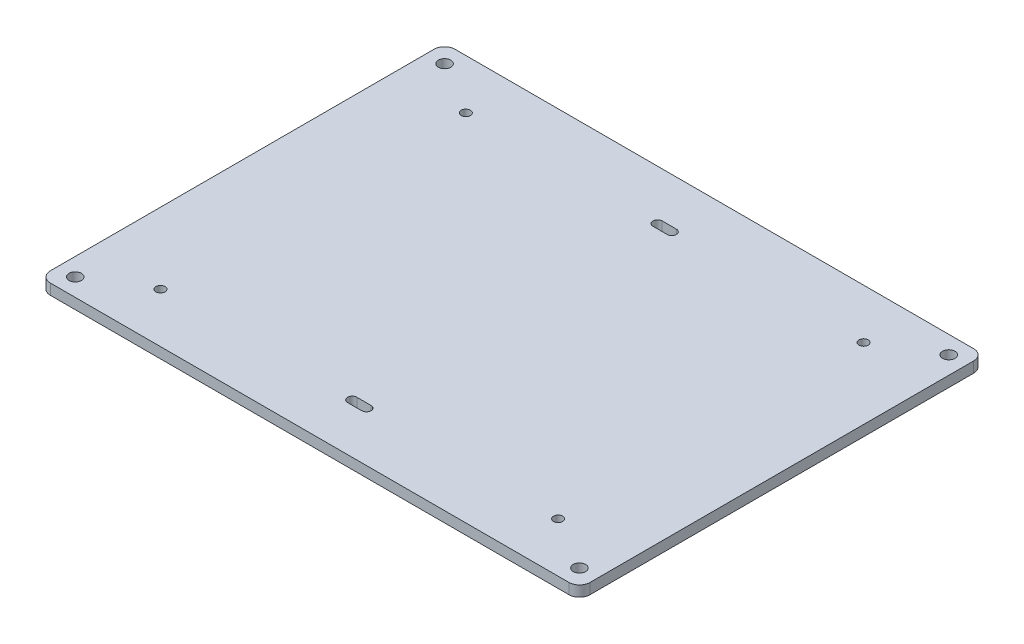
from build123d import *

# Parameters (mm, degrees)
SKETCH_1_R      = 1.75
SKETCH_1_R_2    = 1.3
EXTRUDE_1_DEPTH = 3


with BuildPart() as part:
    # 草图1 → 凸台-拉伸1 (new body)
    with BuildSketch(Plane(origin=(0, 0, 0), x_dir=(1, 0, 0), z_dir=(0, 1, 0))):
        with BuildLine():
            Line((-73, 57), (73, 57))
            ThreePointArc((73, 57), (75.121320344, 56.121320344), (76, 54))
            Line((76, 54), (76, -54))
            ThreePointArc((76, -54), (75.121320344, -56.121320344), (73, -57))
            Line((73, -57), (-73, -57))
            ThreePointArc((-73, -57), (-75.121320344, -56.121320344), (-76, -54))
            Line((-76, -54), (-76, 54))
            ThreePointArc((-76, 54), (-75.121320344, 56.121320344), (-73, 57))
        make_face()
        with Locations((-71, 52)):
            Circle(SKETCH_1_R, mode=Mode.SUBTRACT)
        with Locations((71, 52)):
            Circle(SKETCH_1_R, mode=Mode.SUBTRACT)
        with Locations((71, -52)):
            Circle(SKETCH_1_R, mode=Mode.SUBTRACT)
        with Locations((-71, -52)):
            Circle(SKETCH_1_R, mode=Mode.SUBTRACT)
        with Locations((-56, 43)):
            Circle(SKETCH_1_R_2, mode=Mode.SUBTRACT)
        with Locations((-56, -43)):
            Circle(SKETCH_1_R_2, mode=Mode.SUBTRACT)
        with Locations((56, -43)):
            Circle(SKETCH_1_R_2, mode=Mode.SUBTRACT)
        with Locations((56, 43)):
            Circle(SKETCH_1_R_2, mode=Mode.SUBTRACT)
        with BuildLine():
            Line((-2, 44.3), (2, 44.3))
            ThreePointArc((2, 44.3), (3.3, 43), (2, 41.7))
            Line((2, 41.7), (-2, 41.7))
            ThreePointArc((-2, 41.7), (-3.3, 43), (-2, 44.3))
        make_face(mode=Mode.SUBTRACT)
        with BuildLine():
            Line((-2, -41.7), (2, -41.7))
            ThreePointArc((2, -41.7), (3.3, -43), (2, -44.3))
            Line((2, -44.3), (-2, -44.3))
            ThreePointArc((-2, -44.3), (-3.3, -43), (-2, -41.7))
        make_face(mode=Mode.SUBTRACT)
    extrude(amount=EXTRUDE_1_DEPTH)


solid = part.part
